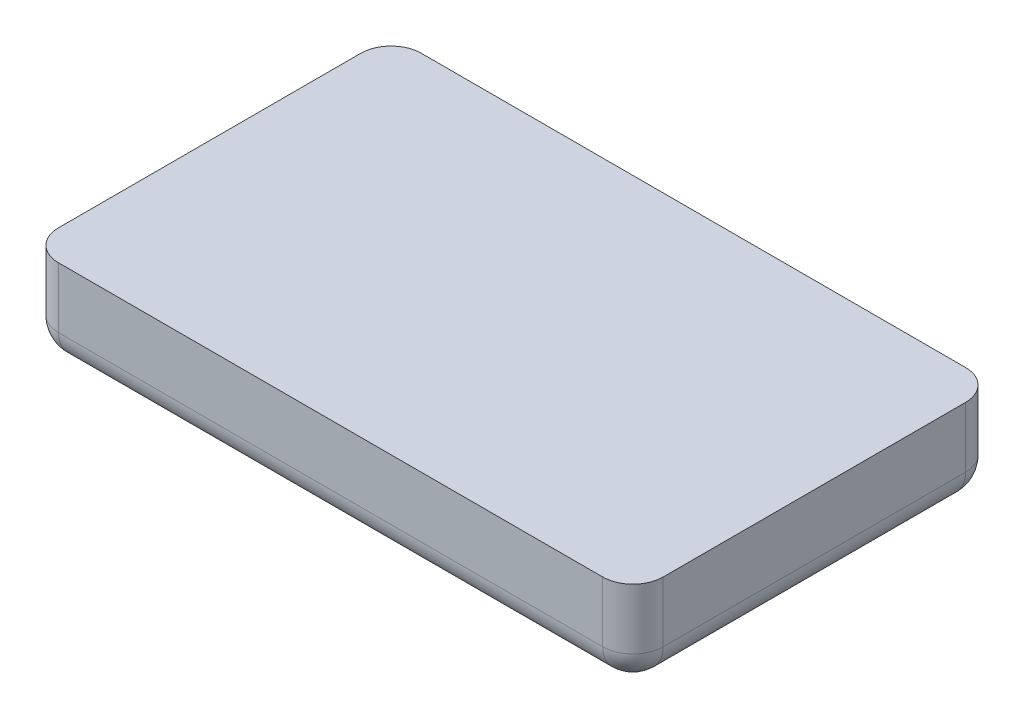
from build123d import *

# Parameters (mm, degrees)
SKETCH1_W           = 200
SKETCH1_H           = 120
BOSS_EXTRUDE1_DEPTH = 30
FILLET1_R           = 10


with BuildPart() as part:
    # Sketch1 → Boss-Extrude1 (new body)
    with BuildSketch(Plane(origin=(0, 0, 0), x_dir=(1, 0, 0), z_dir=(0, 1, 0))):
        with Locations((100, 60)):
            Rectangle(SKETCH1_W, SKETCH1_H)
    extrude(amount=BOSS_EXTRUDE1_DEPTH)

    # Fillet1
    fillet1_edges = [part.edges().sort_by_distance(p)[0] for p in [
        (100, 0, -120),
        (200, 0, -60),
        (100, 0, 0),
        (0, 0, -60),
        (0, 15, -120),
        (200, 15, -120),
        (200, 15, 0),
        (0, 15, 0),
    ]]
    fillet(fillet1_edges, radius=FILLET1_R)


solid = part.part
